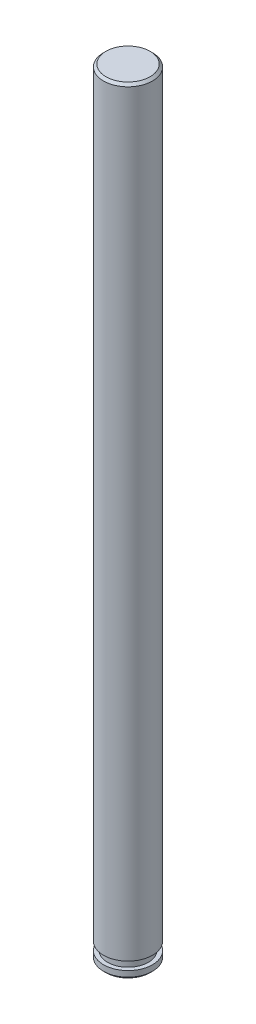
from build123d import *

# Parameters (mm, degrees)
SKETCH1_R           = 1.5
BOSS_EXTRUDE1_DEPTH = 47.5
CHAMFER1_SIZE       = 0.15
CUT_EXTRUDE1_START  = -1
SKETCH2_R           = 1.5
SKETCH2_R_2         = 1.25
CUT_EXTRUDE1_DEPTH  = 0.5


with BuildPart() as part:
    # Sketch1 → Boss-Extrude1 (new body)
    with BuildSketch(Plane(origin=(0, 0, 0), x_dir=(1, 0, 0), z_dir=(0, 1, 0))):
        with Locations(Location((0, 0, 0), (0, 0, 270))):
            Circle(SKETCH1_R)
    extrude(amount=BOSS_EXTRUDE1_DEPTH)

    # Chamfer1
    chamfer1_edges = [part.edges().sort_by_distance(p)[0] for p in [
        (0, 0, -1.5),
        (0, 47.5, -1.5),
    ]]
    chamfer(chamfer1_edges, length=CHAMFER1_SIZE)

    # Sketch2 → Cut-Extrude1 (cut)
    with BuildSketch(Plane.XZ.offset(CUT_EXTRUDE1_START)):
        Circle(SKETCH2_R)
        Circle(SKETCH2_R_2, mode=Mode.SUBTRACT)
    extrude(amount=CUT_EXTRUDE1_DEPTH, mode=Mode.SUBTRACT)


solid = part.part
